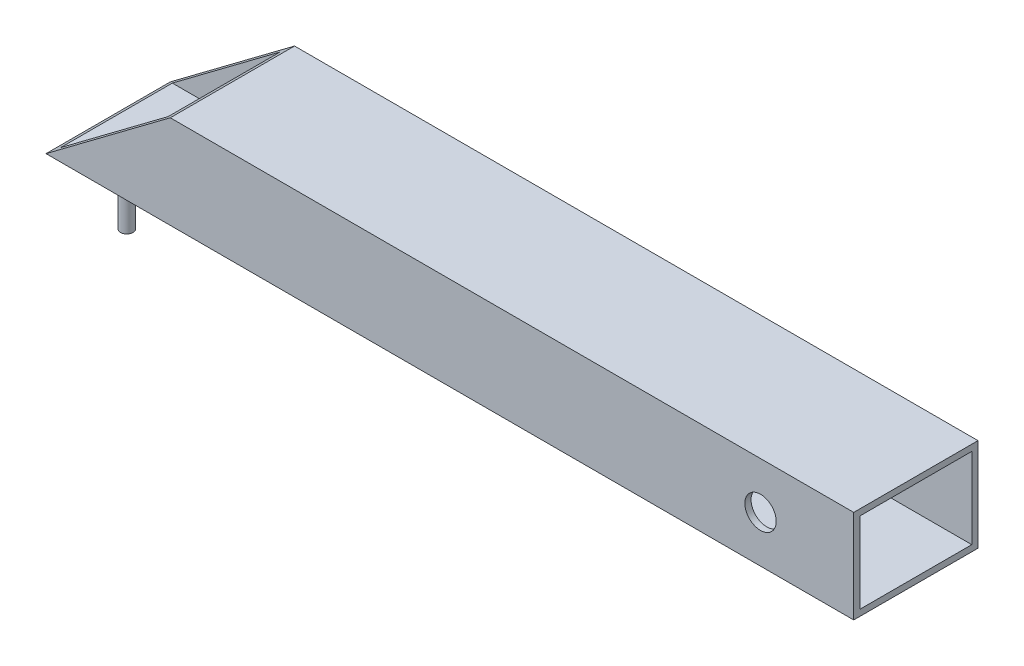
from build123d import *

# Parameters (mm, degrees)
ESQUISSE1_R             = 2.524565825
BOSS_EXTRU_1_DEPTH      = 20
ESQUISSE2_W             = 18
ESQUISSE2_H             = 13
ENL_V_MAT_EXTRU_1_DEPTH = 200
ESQUISSE4_R             = 1
BOSS_EXTRU_2_DEPTH      = 9
ESQUISSE5_R             = 2.5
BOSS_EXTRU_3_DEPTH      = 2


with BuildPart() as part:
    # Esquisse1 → Boss.-Extru.1 (new body)
    with BuildSketch(Plane.XY):
        Polygon((15, -7.5), (-115, -7.5), (-95, 7.5), (15, 7.5), align=None)
        Circle(ESQUISSE1_R, mode=Mode.SUBTRACT)
    extrude(amount=BOSS_EXTRU_1_DEPTH)

    # Esquisse2 → Enlèv. mat.-Extru.1 (cut)
    with BuildSketch(Plane(origin=(15, 0, 0), x_dir=(0, 0, -1), z_dir=(1, 0, 0))):
        with Locations((-10, 0)):
            Rectangle(ESQUISSE2_W, ESQUISSE2_H)
    extrude(amount=-ENL_V_MAT_EXTRU_1_DEPTH, mode=Mode.SUBTRACT)

    # Esquisse4 → Boss.-Extru.2 (add)
    with BuildSketch(Plane.XZ.offset(7.5)):
        with Locations(Location((-107, 15, 0), (0, 0, 180))):
            Circle(ESQUISSE4_R)
        with Locations(Location((-107, 5, 0), (0, 0, 180))):
            Circle(ESQUISSE4_R)
    extrude(amount=BOSS_EXTRU_2_DEPTH)


with BuildPart() as body_2:
    # Esquisse5 → Boss.-Extru.3 (new body)
    with BuildSketch(Plane(origin=(0, 0, 0), x_dir=(-1, 0, 0), z_dir=(0, 0, -1))):
        Circle(ESQUISSE5_R)
    extrude(amount=BOSS_EXTRU_3_DEPTH)


solid = Compound([part.part, body_2.part])
